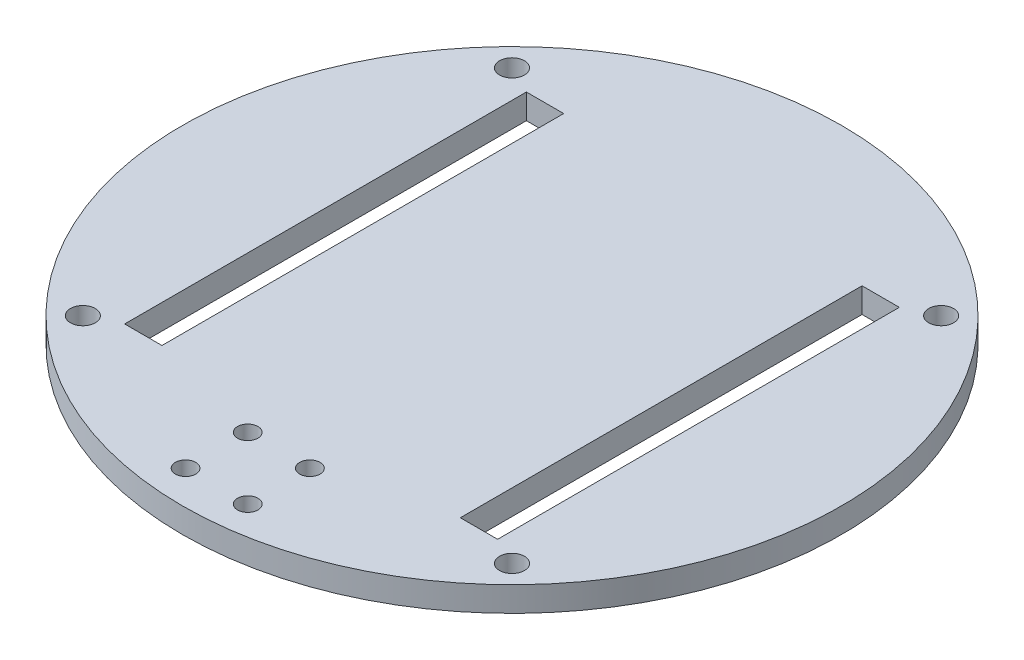
from build123d import *

# Parameters (mm, degrees)
SKETCH1_R           = 84.1675
SKETCH1_W           = 9.525
SKETCH1_H           = 102.603301604
SKETCH1_R_2         = 2.6035
SKETCH1_R_3         = 3.175
BOSS_EXTRUDE1_DEPTH = 6.35


with BuildPart() as part:
    # Sketch1 → Boss-Extrude1 (new body)
    with BuildSketch(Plane(origin=(0, 66.8, 0), x_dir=(1, 0, 0), z_dir=(0, 1, 0))):
        with Locations(Location((0, 0, 0), (0, 0, 270))):
            Circle(SKETCH1_R)
        with Locations((-42.8625, 0)):
            Rectangle(SKETCH1_W, SKETCH1_H, mode=Mode.SUBTRACT)
        with Locations((42.8625, 0)):
            Rectangle(SKETCH1_W, SKETCH1_H, mode=Mode.SUBTRACT)
        with Locations(Location((-7.9375, -59.556650802, 0), (0, 0, 270))):
            Circle(SKETCH1_R_2, mode=Mode.SUBTRACT)
        with Locations(Location((7.9375, -59.556650802, 0), (0, 0, 270))):
            Circle(SKETCH1_R_2, mode=Mode.SUBTRACT)
        with Locations(Location((-54.800775542, -54.800775542, 0), (0, 0, 270))):
            Circle(SKETCH1_R_3, mode=Mode.SUBTRACT)
        with Locations(Location((-7.9375, -75.431650802, 0), (0, 0, 270))):
            Circle(SKETCH1_R_2, mode=Mode.SUBTRACT)
        with Locations(Location((7.9375, -75.431650802, 0), (0, 0, 270))):
            Circle(SKETCH1_R_2, mode=Mode.SUBTRACT)
        with Locations(Location((54.800775542, -54.800775542, 0), (0, 0, 270))):
            Circle(SKETCH1_R_3, mode=Mode.SUBTRACT)
        with Locations(Location((-54.800775542, 54.800775542, 0), (0, 0, 270))):
            Circle(SKETCH1_R_3, mode=Mode.SUBTRACT)
        with Locations(Location((54.800775542, 54.800775542, 0), (0, 0, 270))):
            Circle(SKETCH1_R_3, mode=Mode.SUBTRACT)
    extrude(amount=BOSS_EXTRUDE1_DEPTH)


solid = part.part
